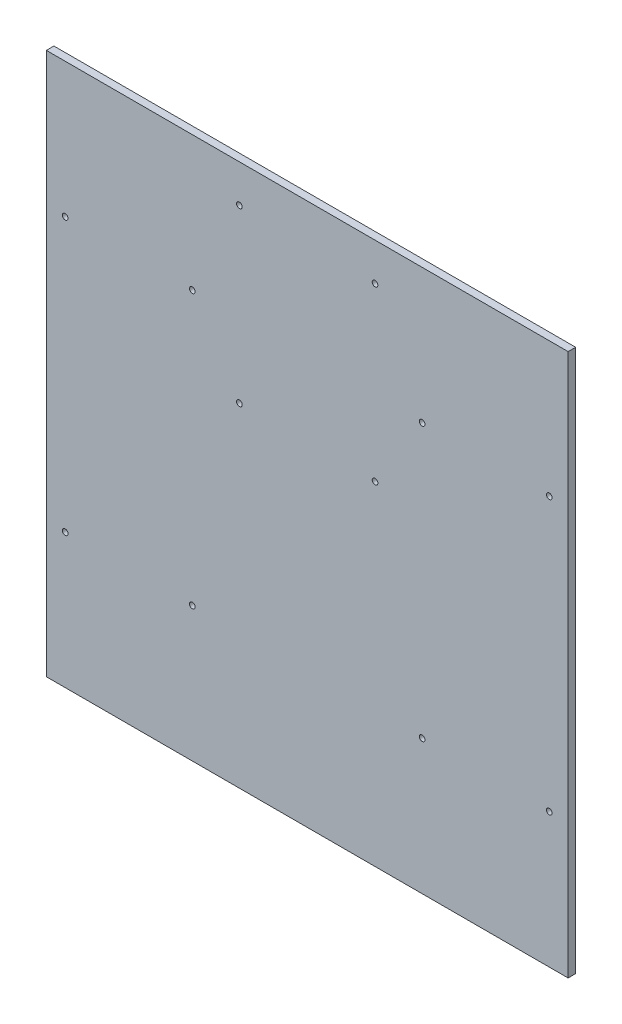
from build123d import *

# Parameters (mm, degrees)
ESQUISSE1_W      = 277
ESQUISSE1_H      = 288
ESQUISSE1_R      = 1.5
EXTRUSION1_DEPTH = 4
ESQUISSE2_R      = 1.5
EXTRUSION2_DEPTH = 10


with BuildPart() as part:
    # Esquisse1 → Extrusion1 (new body)
    with BuildSketch(Plane.XY):
        with Locations((121.409208357, -102.819578947)):
            Rectangle(ESQUISSE1_W, ESQUISSE1_H)
        with Locations((182.409208357, -175.319578947)):
            Circle(ESQUISSE1_R, mode=Mode.SUBTRACT)
        with Locations((182.409208357, -30.319578947)):
            Circle(ESQUISSE1_R, mode=Mode.SUBTRACT)
        with Locations((249.909208357, -30.319578947)):
            Circle(ESQUISSE1_R, mode=Mode.SUBTRACT)
        with Locations((249.909208357, -175.319578947)):
            Circle(ESQUISSE1_R, mode=Mode.SUBTRACT)
        with Locations(Location((-7.090791643, -175.319578947, 0), (0, 0, 180))):
            Circle(ESQUISSE1_R, mode=Mode.SUBTRACT)
        with Locations(Location((-7.090791643, -30.319578947, 0), (0, 0, 180))):
            Circle(ESQUISSE1_R, mode=Mode.SUBTRACT)
        with Locations(Location((60.409208357, -30.319578947, 0), (0, 0, 180))):
            Circle(ESQUISSE1_R, mode=Mode.SUBTRACT)
        with Locations(Location((60.409208357, -175.319578947, 0), (0, 0, 180))):
            Circle(ESQUISSE1_R, mode=Mode.SUBTRACT)
    extrude(amount=EXTRUSION1_DEPTH)

    # Esquisse2 → Extrusion2 (cut)
    with BuildSketch(Plane.XY.offset(4)):
        with Locations((85.409208357, 21.180421053)):
            Circle(ESQUISSE2_R)
        with Locations((85.409208357, -69.819578947)):
            Circle(ESQUISSE2_R)
        with Locations((157.409208357, -69.819578947)):
            Circle(ESQUISSE2_R)
        with Locations((157.409208357, 21.180421053)):
            Circle(ESQUISSE2_R)
    extrude(amount=-EXTRUSION2_DEPTH, mode=Mode.SUBTRACT)


solid = part.part
